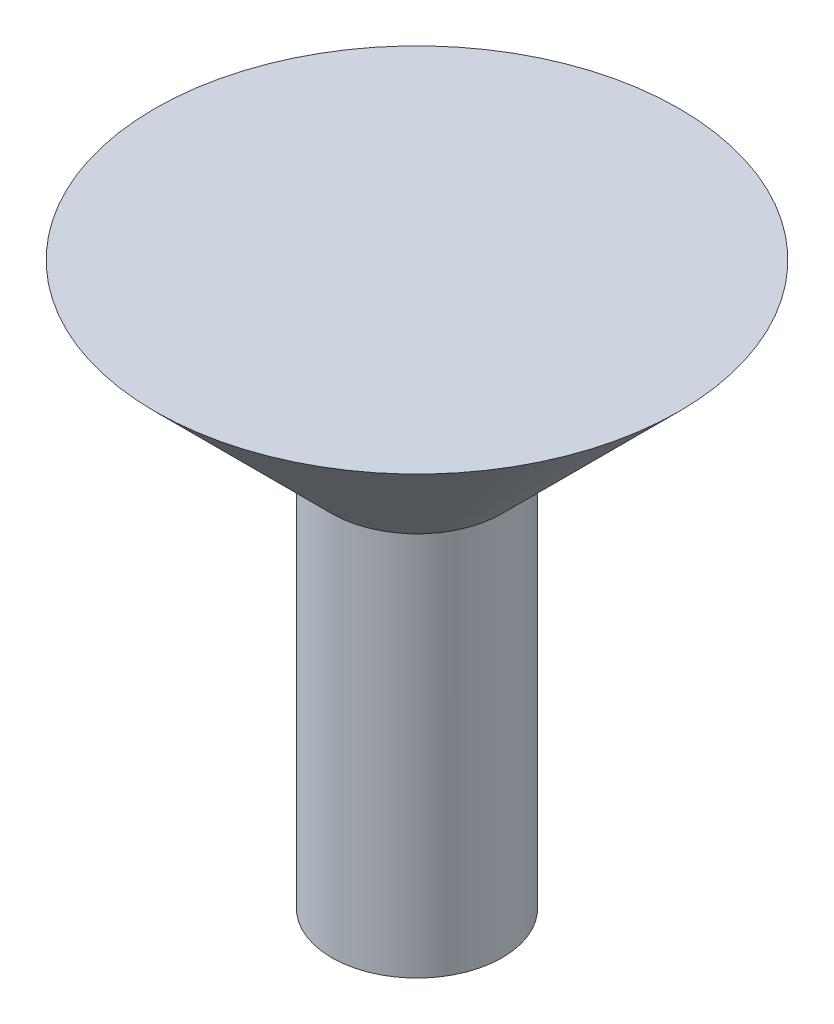
from build123d import *

# Parameters (mm, degrees)
SKETCH2_R           = 2.217157288
BOSS_EXTRUDE1_DEPTH = 10
SKETCH3_R           = 1.55
BOSS_EXTRUDE2_DEPTH = 3
SKETCH3_2_R         = 1.55
CUT_EXTRUDE1_DEPTH  = 5


with BuildPart() as part:
    # Sketch1 → Revolve1 (revolve)
    with BuildSketch(Plane.XY):
        Polygon((-0.2, 2.3), (-0.2, -2.3), (-2.417157288, -2.3), (-7.017157288, 2.3), align=None)
    revolve(axis=Axis((-0.2, 2.3, 0), (0, -1, 0)))

    # Sketch2 → Boss-Extrude1 (add)
    with BuildSketch(Plane.XZ.offset(2.3)):
        with Locations((-0.2, 0)):
            Circle(SKETCH2_R)
    extrude(amount=BOSS_EXTRUDE1_DEPTH)

    # Sketch3 → Boss-Extrude2 (add)
    with BuildSketch(Plane.XZ.offset(12.3)):
        with Locations((-0.2, 0)):
            Circle(SKETCH3_R)
    extrude(amount=-BOSS_EXTRUDE2_DEPTH)

    # Sketch3<2> → Cut-Extrude1 (cut)
    with BuildSketch(Plane.XZ.offset(12.3)):
        with Locations((-0.2, 0)):
            Circle(SKETCH3_2_R)
    extrude(amount=-CUT_EXTRUDE1_DEPTH, mode=Mode.SUBTRACT)


solid = part.part
